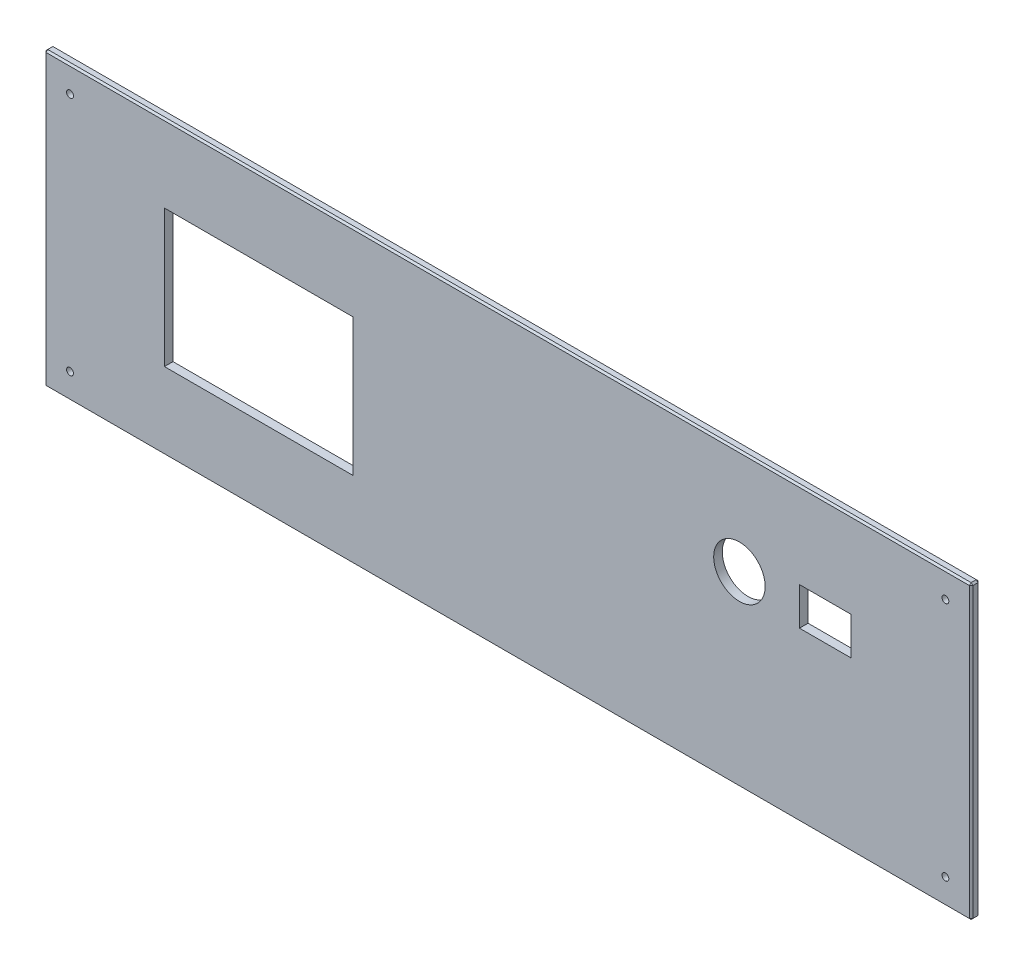
from build123d import *

# Parameters (mm, degrees)
SKETCH1_W           = 540
SKETCH1_H           = 170
BOSS_EXTRUDE1_DEPTH = 5
CHAMFER1_SIZE       = 1
SKETCH2_R           = 2
CUT_EXTRUDE1_DEPTH  = 5
SKETCH3_R           = 15
SKETCH3_W           = 30
SKETCH3_H           = 22
SKETCH3_W_2         = 110
SKETCH3_H_2         = 80
CUT_EXTRUDE2_DEPTH  = 10


with BuildPart() as part:
    # Sketch1 → Boss-Extrude1 (new body)
    with BuildSketch(Plane.XY):
        with Locations((270, 85)):
            Rectangle(SKETCH1_W, SKETCH1_H)
    extrude(amount=BOSS_EXTRUDE1_DEPTH)

    # Chamfer1
    chamfer1_edges = [part.edges().sort_by_distance(p)[0] for p in [
        (540, 85, 5),
        (270, 170, 5),
        (0, 85, 5),
        (270, 170, 0),
        (540, 85, 0),
        (270, 0, 0),
        (0, 85, 0),
        (0, 170, 2.5),
        (540, 170, 2.5),
        (540, 0, 2.5),
        (0, 0, 2.5),
        (270, 0, 5),
    ]]
    chamfer(chamfer1_edges, length=CHAMFER1_SIZE)

    # Sketch2 → Cut-Extrude1 (cut)
    with BuildSketch(Plane.XY.offset(5)):
        with Locations((525, 155)):
            Circle(SKETCH2_R)
        with Locations((525, 15)):
            Circle(SKETCH2_R)
        with Locations((15, 155)):
            Circle(SKETCH2_R)
        with Locations((15, 15)):
            Circle(SKETCH2_R)
    extrude(amount=-CUT_EXTRUDE1_DEPTH, mode=Mode.SUBTRACT)

    # Sketch3 → Cut-Extrude2 (cut)
    with BuildSketch(Plane(origin=(0, 0, 0), x_dir=(-1, 0, 0), z_dir=(0, 0, -1))):
        with Locations((-405, 109)):
            Circle(SKETCH3_R)
        with Locations((-455, 109)):
            Rectangle(SKETCH3_W, SKETCH3_H)
        with Locations((-125, 85)):
            Rectangle(SKETCH3_W_2, SKETCH3_H_2)
    extrude(amount=-CUT_EXTRUDE2_DEPTH, mode=Mode.SUBTRACT)


solid = part.part
